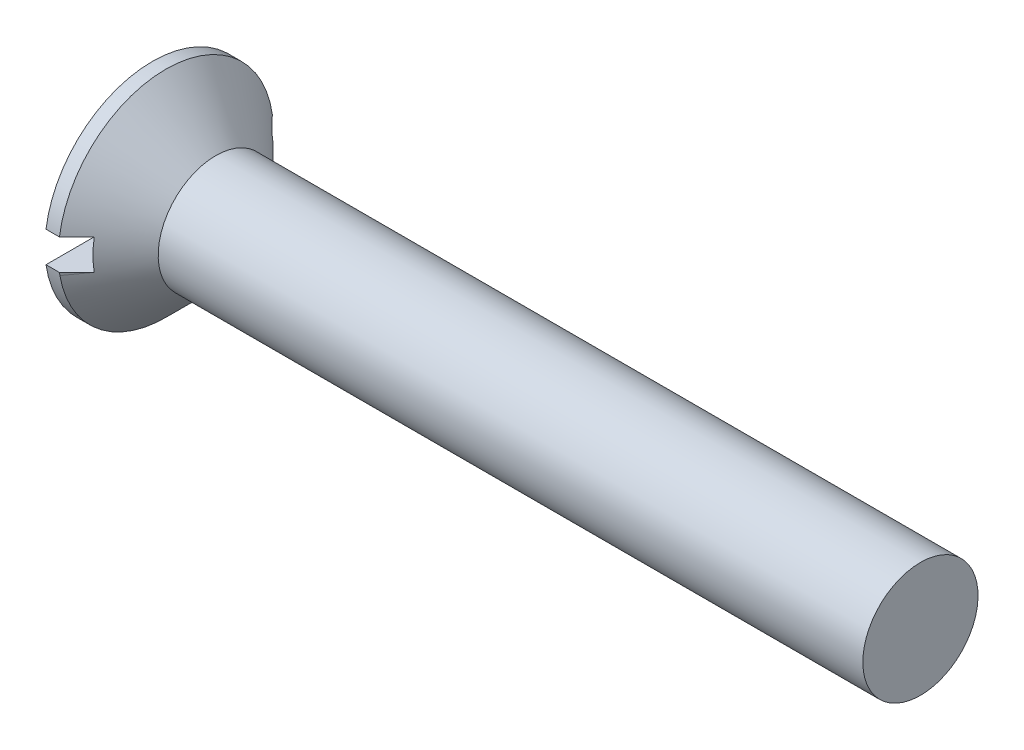
from build123d import *

# Parameters (mm, degrees)
SKETCH2_W          = 5.6
SKETCH2_H          = 0.8
CUT_EXTRUDE1_DEPTH = 0.8


with BuildPart() as part:
    # Sketch1 → Revolve1 (revolve)
    with BuildSketch(Plane.XY):
        Polygon((0, 0), (0, 2.8), (0.35, 2.8), (1.65, 1.5), (20, 1.5), (20, 0), align=None)
    revolve(axis=Axis((20, 0, 0), (-1, 0, 0)))

    # Sketch2 → Cut-Extrude1 (cut)
    with BuildSketch(Plane.ZY):
        Rectangle(SKETCH2_W, SKETCH2_H)
    extrude(amount=-CUT_EXTRUDE1_DEPTH, mode=Mode.SUBTRACT)


solid = part.part
